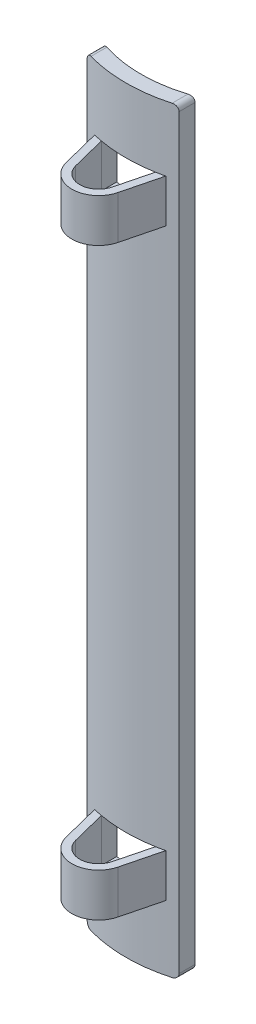
from build123d import *

# Parameters (mm, degrees)
PROFILE_DEPTH    = 35
SUPPORTCUTS_W    = 5
SUPPORTCUTS_H    = 4
SUPPORTCUT_DEPTH = 38.898185972
RODGUIDE_DEPTH   = 4
PROFILEFILLET_R  = 0.5


with BuildPart() as part:
    # ProfileS → Profile (new, symmetric)
    with BuildSketch(Plane(origin=(0, 0, 0), x_dir=(1, 0, 0), z_dir=(0, 1, 0))):
        with BuildLine():
            Line((-4.25, -11.755317946), (-4.25, -13.234330357))
            ThreePointArc((-4.25, -13.234330357), (0, -13.9), (4.25, -13.234330357))
            Line((4.25, -13.234330357), (4.25, -11.755317946))
            ThreePointArc((4.25, -11.755317946), (0, -12.5), (-4.25, -11.755317946))
        make_face()
    extrude(amount=PROFILE_DEPTH, both=True)

    # SupportCutS → SupportCut (cut, through all)
    with BuildSketch(Plane.XY):
        with Locations((0, 27)):
            Rectangle(SUPPORTCUTS_W, SUPPORTCUTS_H)
    supportcut = extrude(amount=SUPPORTCUT_DEPTH, mode=Mode.SUBTRACT)

    # RodGuideS → RodGuide (add)
    with BuildSketch(Plane.XZ.offset(-29)):
        with BuildLine():
            Line((-2.5, 13.673331708), (-1.696790343, 16.855729335))
            ThreePointArc((-1.696790343, 16.855729335), (0, 18.177474117), (1.696790343, 16.855729335))
            Line((1.696790343, 16.855729335), (2.5, 13.673331708))
            ThreePointArc((2.5, 13.673331708), (2.894968306, 13.5951888), (3.287507688, 13.505639311))
            Line((3.287507688, 13.505639311), (2.397347452, 17.032543895))
            ThreePointArc((2.397347452, 17.032543895), (0, 18.9), (-2.397347452, 17.032543895))
            Line((-2.397347452, 17.032543895), (-3.287507688, 13.505639311))
            ThreePointArc((-3.287507688, 13.505639311), (-2.894968306, 13.5951888), (-2.5, 13.673331708))
        make_face()
    rodguide = extrude(amount=RODGUIDE_DEPTH)

    # SCVM: SupportCut, RodGuide across plane
    add(supportcut.mirror(Plane.ZX), mode=Mode.SUBTRACT)
    add(rodguide.mirror(Plane.ZX))

    # ProfileFillet
    profilefillet_edges = [part.edges().sort_by_distance(p)[0] for p in [
        (4.25, 35, 12.494824151),
        (4.25, -35, 12.494824151),
        (-4.25, -35, 12.494824151),
        (-4.25, 35, 12.494824151),
    ]]
    fillet(profilefillet_edges, radius=PROFILEFILLET_R)


solid = part.part
